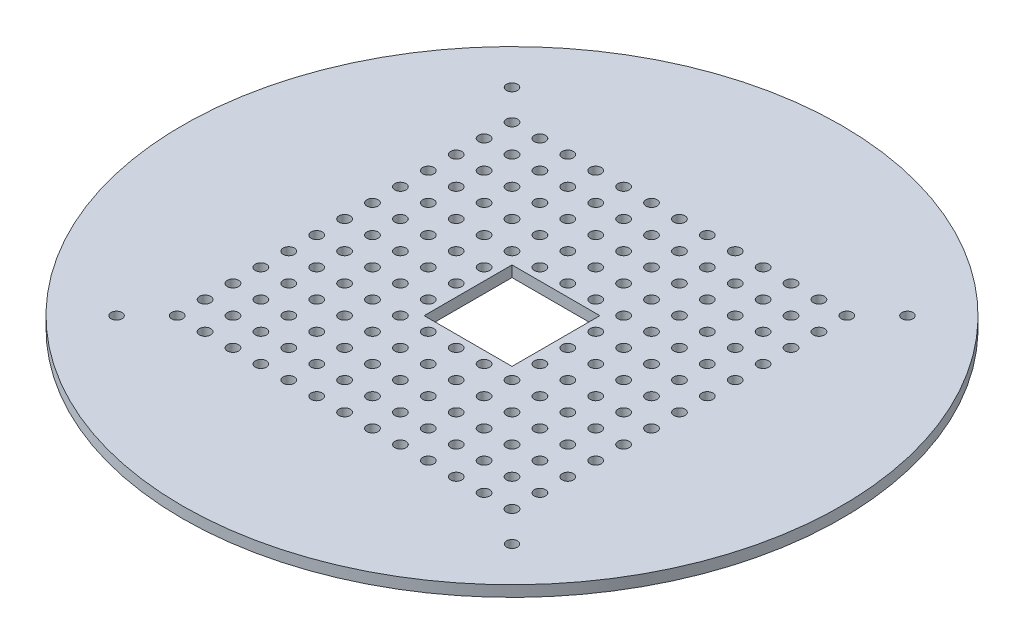
from build123d import *

# Parameters (mm, degrees)
SKETCH_1_R          = 150
SKETCH_1_R_2        = 2.5
SKETCH_1_R_3        = 2.54
EXTRUDE_1_DEPTH     = 5
SKETCH_2_W          = 40
SKETCH_2_H          = 40
CUT_EXTRUDE_1_DEPTH = 213.190951739


with BuildPart() as part:
    # 草图1 → 凸台-拉伸1 (new body)
    with BuildSketch(Plane(origin=(0, 0, 0), x_dir=(1, 0, 0), z_dir=(0, 1, 0))):
        with Locations(Location((0, 0, 0), (0, 0, 270))):
            Circle(SKETCH_1_R)
        with Locations(Location((90, -90, 0), (0, 0, 270))):
            Circle(SKETCH_1_R_2, mode=Mode.SUBTRACT)
        with Locations(Location((90, 90, 0), (0, 0, 270))):
            Circle(SKETCH_1_R_2, mode=Mode.SUBTRACT)
        with Locations(Location((-90, -90, 0), (0, 0, 270))):
            Circle(SKETCH_1_R_2, mode=Mode.SUBTRACT)
        with Locations(Location((-90, 90, 0), (0, 0, 270))):
            Circle(SKETCH_1_R_2, mode=Mode.SUBTRACT)
        with Locations(Location((76.2, 76.2, 0), (0, 0, 270))):
            Circle(SKETCH_1_R_3, mode=Mode.SUBTRACT)
        with Locations(Location((63.5, 76.2, 0), (0, 0, 270))):
            Circle(SKETCH_1_R_3, mode=Mode.SUBTRACT)
        with Locations(Location((50.8, 76.2, 0), (0, 0, 270))):
            Circle(SKETCH_1_R_3, mode=Mode.SUBTRACT)
        with Locations(Location((38.1, 76.2, 0), (0, 0, 270))):
            Circle(SKETCH_1_R_3, mode=Mode.SUBTRACT)
        with Locations(Location((25.4, 76.2, 0), (0, 0, 270))):
            Circle(SKETCH_1_R_3, mode=Mode.SUBTRACT)
        with Locations(Location((12.7, 76.2, 0), (0, 0, 270))):
            Circle(SKETCH_1_R_3, mode=Mode.SUBTRACT)
        with Locations(Location((0, 76.2, 0), (0, 0, 270))):
            Circle(SKETCH_1_R_3, mode=Mode.SUBTRACT)
        with Locations(Location((-12.7, 76.2, 0), (0, 0, 270))):
            Circle(SKETCH_1_R_3, mode=Mode.SUBTRACT)
        with Locations(Location((-25.4, 76.2, 0), (0, 0, 270))):
            Circle(SKETCH_1_R_3, mode=Mode.SUBTRACT)
        with Locations(Location((-38.1, 76.2, 0), (0, 0, 270))):
            Circle(SKETCH_1_R_3, mode=Mode.SUBTRACT)
        with Locations(Location((-50.8, 76.2, 0), (0, 0, 270))):
            Circle(SKETCH_1_R_3, mode=Mode.SUBTRACT)
        with Locations(Location((-63.5, 76.2, 0), (0, 0, 270))):
            Circle(SKETCH_1_R_3, mode=Mode.SUBTRACT)
        with Locations(Location((-76.2, 76.2, 0), (0, 0, 270))):
            Circle(SKETCH_1_R_3, mode=Mode.SUBTRACT)
        with Locations(Location((63.5, 63.5, 0), (0, 0, 270))):
            Circle(SKETCH_1_R_3, mode=Mode.SUBTRACT)
        with Locations(Location((50.8, 63.5, 0), (0, 0, 270))):
            Circle(SKETCH_1_R_3, mode=Mode.SUBTRACT)
        with Locations(Location((38.1, 63.5, 0), (0, 0, 270))):
            Circle(SKETCH_1_R_3, mode=Mode.SUBTRACT)
        with Locations(Location((25.4, 63.5, 0), (0, 0, 270))):
            Circle(SKETCH_1_R_3, mode=Mode.SUBTRACT)
        with Locations(Location((12.7, 63.5, 0), (0, 0, 270))):
            Circle(SKETCH_1_R_3, mode=Mode.SUBTRACT)
        with Locations(Location((0, 63.5, 0), (0, 0, 270))):
            Circle(SKETCH_1_R_3, mode=Mode.SUBTRACT)
        with Locations(Location((-12.7, 63.5, 0), (0, 0, 270))):
            Circle(SKETCH_1_R_3, mode=Mode.SUBTRACT)
        with Locations(Location((-25.4, 63.5, 0), (0, 0, 270))):
            Circle(SKETCH_1_R_3, mode=Mode.SUBTRACT)
        with Locations(Location((-38.1, 63.5, 0), (0, 0, 270))):
            Circle(SKETCH_1_R_3, mode=Mode.SUBTRACT)
        with Locations(Location((-50.8, 63.5, 0), (0, 0, 270))):
            Circle(SKETCH_1_R_3, mode=Mode.SUBTRACT)
        with Locations(Location((-63.5, 63.5, 0), (0, 0, 270))):
            Circle(SKETCH_1_R_3, mode=Mode.SUBTRACT)
        with Locations(Location((-76.2, 63.5, 0), (0, 0, 270))):
            Circle(SKETCH_1_R_3, mode=Mode.SUBTRACT)
        with Locations(Location((63.5, 50.8, 0), (0, 0, 270))):
            Circle(SKETCH_1_R_3, mode=Mode.SUBTRACT)
        with Locations(Location((50.8, 50.8, 0), (0, 0, 270))):
            Circle(SKETCH_1_R_3, mode=Mode.SUBTRACT)
        with Locations(Location((38.1, 50.8, 0), (0, 0, 270))):
            Circle(SKETCH_1_R_3, mode=Mode.SUBTRACT)
        with Locations(Location((25.4, 50.8, 0), (0, 0, 270))):
            Circle(SKETCH_1_R_3, mode=Mode.SUBTRACT)
        with Locations(Location((12.7, 50.8, 0), (0, 0, 270))):
            Circle(SKETCH_1_R_3, mode=Mode.SUBTRACT)
        with Locations(Location((0, 50.8, 0), (0, 0, 270))):
            Circle(SKETCH_1_R_3, mode=Mode.SUBTRACT)
        with Locations(Location((-12.7, 50.8, 0), (0, 0, 270))):
            Circle(SKETCH_1_R_3, mode=Mode.SUBTRACT)
        with Locations(Location((-25.4, 50.8, 0), (0, 0, 270))):
            Circle(SKETCH_1_R_3, mode=Mode.SUBTRACT)
        with Locations(Location((-38.1, 50.8, 0), (0, 0, 270))):
            Circle(SKETCH_1_R_3, mode=Mode.SUBTRACT)
        with Locations(Location((-50.8, 50.8, 0), (0, 0, 270))):
            Circle(SKETCH_1_R_3, mode=Mode.SUBTRACT)
        with Locations(Location((-63.5, 50.8, 0), (0, 0, 270))):
            Circle(SKETCH_1_R_3, mode=Mode.SUBTRACT)
        with Locations(Location((-76.2, 50.8, 0), (0, 0, 270))):
            Circle(SKETCH_1_R_3, mode=Mode.SUBTRACT)
        with Locations(Location((63.5, 38.1, 0), (0, 0, 270))):
            Circle(SKETCH_1_R_3, mode=Mode.SUBTRACT)
        with Locations(Location((50.8, 38.1, 0), (0, 0, 270))):
            Circle(SKETCH_1_R_3, mode=Mode.SUBTRACT)
        with Locations(Location((38.1, 38.1, 0), (0, 0, 270))):
            Circle(SKETCH_1_R_3, mode=Mode.SUBTRACT)
        with Locations(Location((25.4, 38.1, 0), (0, 0, 270))):
            Circle(SKETCH_1_R_3, mode=Mode.SUBTRACT)
        with Locations(Location((12.7, 38.1, 0), (0, 0, 270))):
            Circle(SKETCH_1_R_3, mode=Mode.SUBTRACT)
        with Locations(Location((0, 38.1, 0), (0, 0, 270))):
            Circle(SKETCH_1_R_3, mode=Mode.SUBTRACT)
        with Locations(Location((-12.7, 38.1, 0), (0, 0, 270))):
            Circle(SKETCH_1_R_3, mode=Mode.SUBTRACT)
        with Locations(Location((-25.4, 38.1, 0), (0, 0, 270))):
            Circle(SKETCH_1_R_3, mode=Mode.SUBTRACT)
        with Locations(Location((-38.1, 38.1, 0), (0, 0, 270))):
            Circle(SKETCH_1_R_3, mode=Mode.SUBTRACT)
        with Locations(Location((-50.8, 38.1, 0), (0, 0, 270))):
            Circle(SKETCH_1_R_3, mode=Mode.SUBTRACT)
        with Locations(Location((-63.5, 38.1, 0), (0, 0, 270))):
            Circle(SKETCH_1_R_3, mode=Mode.SUBTRACT)
        with Locations(Location((-76.2, 38.1, 0), (0, 0, 270))):
            Circle(SKETCH_1_R_3, mode=Mode.SUBTRACT)
        with Locations(Location((63.5, 25.4, 0), (0, 0, 270))):
            Circle(SKETCH_1_R_3, mode=Mode.SUBTRACT)
        with Locations(Location((50.8, 25.4, 0), (0, 0, 270))):
            Circle(SKETCH_1_R_3, mode=Mode.SUBTRACT)
        with Locations(Location((38.1, 25.4, 0), (0, 0, 270))):
            Circle(SKETCH_1_R_3, mode=Mode.SUBTRACT)
        with Locations(Location((25.4, 25.4, 0), (0, 0, 270))):
            Circle(SKETCH_1_R_3, mode=Mode.SUBTRACT)
        with Locations(Location((12.7, 25.4, 0), (0, 0, 270))):
            Circle(SKETCH_1_R_3, mode=Mode.SUBTRACT)
        with Locations(Location((0, 25.4, 0), (0, 0, 270))):
            Circle(SKETCH_1_R_3, mode=Mode.SUBTRACT)
        with Locations(Location((-12.7, 25.4, 0), (0, 0, 270))):
            Circle(SKETCH_1_R_3, mode=Mode.SUBTRACT)
        with Locations(Location((-25.4, 25.4, 0), (0, 0, 270))):
            Circle(SKETCH_1_R_3, mode=Mode.SUBTRACT)
        with Locations(Location((-38.1, 25.4, 0), (0, 0, 270))):
            Circle(SKETCH_1_R_3, mode=Mode.SUBTRACT)
        with Locations(Location((-50.8, 25.4, 0), (0, 0, 270))):
            Circle(SKETCH_1_R_3, mode=Mode.SUBTRACT)
        with Locations(Location((-63.5, 25.4, 0), (0, 0, 270))):
            Circle(SKETCH_1_R_3, mode=Mode.SUBTRACT)
        with Locations(Location((-76.2, 25.4, 0), (0, 0, 270))):
            Circle(SKETCH_1_R_3, mode=Mode.SUBTRACT)
        with Locations(Location((63.5, 12.7, 0), (0, 0, 270))):
            Circle(SKETCH_1_R_3, mode=Mode.SUBTRACT)
        with Locations(Location((50.8, 12.7, 0), (0, 0, 270))):
            Circle(SKETCH_1_R_3, mode=Mode.SUBTRACT)
        with Locations(Location((38.1, 12.7, 0), (0, 0, 270))):
            Circle(SKETCH_1_R_3, mode=Mode.SUBTRACT)
        with Locations(Location((25.4, 12.7, 0), (0, 0, 270))):
            Circle(SKETCH_1_R_3, mode=Mode.SUBTRACT)
        with Locations(Location((12.7, 12.7, 0), (0, 0, 270))):
            Circle(SKETCH_1_R_3, mode=Mode.SUBTRACT)
        with Locations(Location((0, 12.7, 0), (0, 0, 270))):
            Circle(SKETCH_1_R_3, mode=Mode.SUBTRACT)
        with Locations(Location((-12.7, 12.7, 0), (0, 0, 270))):
            Circle(SKETCH_1_R_3, mode=Mode.SUBTRACT)
        with Locations(Location((-25.4, 12.7, 0), (0, 0, 270))):
            Circle(SKETCH_1_R_3, mode=Mode.SUBTRACT)
        with Locations(Location((-38.1, 12.7, 0), (0, 0, 270))):
            Circle(SKETCH_1_R_3, mode=Mode.SUBTRACT)
        with Locations(Location((-50.8, 12.7, 0), (0, 0, 270))):
            Circle(SKETCH_1_R_3, mode=Mode.SUBTRACT)
        with Locations(Location((-63.5, 12.7, 0), (0, 0, 270))):
            Circle(SKETCH_1_R_3, mode=Mode.SUBTRACT)
        with Locations(Location((-76.2, 12.7, 0), (0, 0, 270))):
            Circle(SKETCH_1_R_3, mode=Mode.SUBTRACT)
        with Locations(Location((63.5, 0, 0), (0, 0, 270))):
            Circle(SKETCH_1_R_3, mode=Mode.SUBTRACT)
        with Locations(Location((50.8, 0, 0), (0, 0, 270))):
            Circle(SKETCH_1_R_3, mode=Mode.SUBTRACT)
        with Locations(Location((38.1, 0, 0), (0, 0, 270))):
            Circle(SKETCH_1_R_3, mode=Mode.SUBTRACT)
        with Locations(Location((25.4, 0, 0), (0, 0, 270))):
            Circle(SKETCH_1_R_3, mode=Mode.SUBTRACT)
        with Locations(Location((12.7, 0, 0), (0, 0, 270))):
            Circle(SKETCH_1_R_3, mode=Mode.SUBTRACT)
        with Locations(Location((0, 0, 0), (0, 0, 270))):
            Circle(SKETCH_1_R_3, mode=Mode.SUBTRACT)
        with Locations(Location((-12.7, 0, 0), (0, 0, 270))):
            Circle(SKETCH_1_R_3, mode=Mode.SUBTRACT)
        with Locations(Location((-25.4, 0, 0), (0, 0, 270))):
            Circle(SKETCH_1_R_3, mode=Mode.SUBTRACT)
        with Locations(Location((-38.1, 0, 0), (0, 0, 270))):
            Circle(SKETCH_1_R_3, mode=Mode.SUBTRACT)
        with Locations(Location((-50.8, 0, 0), (0, 0, 270))):
            Circle(SKETCH_1_R_3, mode=Mode.SUBTRACT)
        with Locations(Location((-63.5, 0, 0), (0, 0, 270))):
            Circle(SKETCH_1_R_3, mode=Mode.SUBTRACT)
        with Locations(Location((-76.2, 0, 0), (0, 0, 270))):
            Circle(SKETCH_1_R_3, mode=Mode.SUBTRACT)
        with Locations(Location((63.5, -12.7, 0), (0, 0, 270))):
            Circle(SKETCH_1_R_3, mode=Mode.SUBTRACT)
        with Locations(Location((50.8, -12.7, 0), (0, 0, 270))):
            Circle(SKETCH_1_R_3, mode=Mode.SUBTRACT)
        with Locations(Location((38.1, -12.7, 0), (0, 0, 270))):
            Circle(SKETCH_1_R_3, mode=Mode.SUBTRACT)
        with Locations(Location((25.4, -12.7, 0), (0, 0, 270))):
            Circle(SKETCH_1_R_3, mode=Mode.SUBTRACT)
        with Locations(Location((12.7, -12.7, 0), (0, 0, 270))):
            Circle(SKETCH_1_R_3, mode=Mode.SUBTRACT)
        with Locations(Location((0, -12.7, 0), (0, 0, 270))):
            Circle(SKETCH_1_R_3, mode=Mode.SUBTRACT)
        with Locations(Location((-12.7, -12.7, 0), (0, 0, 270))):
            Circle(SKETCH_1_R_3, mode=Mode.SUBTRACT)
        with Locations(Location((-25.4, -12.7, 0), (0, 0, 270))):
            Circle(SKETCH_1_R_3, mode=Mode.SUBTRACT)
        with Locations(Location((-38.1, -12.7, 0), (0, 0, 270))):
            Circle(SKETCH_1_R_3, mode=Mode.SUBTRACT)
        with Locations(Location((-50.8, -12.7, 0), (0, 0, 270))):
            Circle(SKETCH_1_R_3, mode=Mode.SUBTRACT)
        with Locations(Location((-63.5, -12.7, 0), (0, 0, 270))):
            Circle(SKETCH_1_R_3, mode=Mode.SUBTRACT)
        with Locations(Location((-76.2, -12.7, 0), (0, 0, 270))):
            Circle(SKETCH_1_R_3, mode=Mode.SUBTRACT)
        with Locations(Location((63.5, -25.4, 0), (0, 0, 270))):
            Circle(SKETCH_1_R_3, mode=Mode.SUBTRACT)
        with Locations(Location((50.8, -25.4, 0), (0, 0, 270))):
            Circle(SKETCH_1_R_3, mode=Mode.SUBTRACT)
        with Locations(Location((38.1, -25.4, 0), (0, 0, 270))):
            Circle(SKETCH_1_R_3, mode=Mode.SUBTRACT)
        with Locations(Location((25.4, -25.4, 0), (0, 0, 270))):
            Circle(SKETCH_1_R_3, mode=Mode.SUBTRACT)
        with Locations(Location((12.7, -25.4, 0), (0, 0, 270))):
            Circle(SKETCH_1_R_3, mode=Mode.SUBTRACT)
        with Locations(Location((0, -25.4, 0), (0, 0, 270))):
            Circle(SKETCH_1_R_3, mode=Mode.SUBTRACT)
        with Locations(Location((-12.7, -25.4, 0), (0, 0, 270))):
            Circle(SKETCH_1_R_3, mode=Mode.SUBTRACT)
        with Locations(Location((-25.4, -25.4, 0), (0, 0, 270))):
            Circle(SKETCH_1_R_3, mode=Mode.SUBTRACT)
        with Locations(Location((-38.1, -25.4, 0), (0, 0, 270))):
            Circle(SKETCH_1_R_3, mode=Mode.SUBTRACT)
        with Locations(Location((-50.8, -25.4, 0), (0, 0, 270))):
            Circle(SKETCH_1_R_3, mode=Mode.SUBTRACT)
        with Locations(Location((-63.5, -25.4, 0), (0, 0, 270))):
            Circle(SKETCH_1_R_3, mode=Mode.SUBTRACT)
        with Locations(Location((-76.2, -25.4, 0), (0, 0, 270))):
            Circle(SKETCH_1_R_3, mode=Mode.SUBTRACT)
        with Locations(Location((63.5, -38.1, 0), (0, 0, 270))):
            Circle(SKETCH_1_R_3, mode=Mode.SUBTRACT)
        with Locations(Location((50.8, -38.1, 0), (0, 0, 270))):
            Circle(SKETCH_1_R_3, mode=Mode.SUBTRACT)
        with Locations(Location((38.1, -38.1, 0), (0, 0, 270))):
            Circle(SKETCH_1_R_3, mode=Mode.SUBTRACT)
        with Locations(Location((25.4, -38.1, 0), (0, 0, 270))):
            Circle(SKETCH_1_R_3, mode=Mode.SUBTRACT)
        with Locations(Location((12.7, -38.1, 0), (0, 0, 270))):
            Circle(SKETCH_1_R_3, mode=Mode.SUBTRACT)
        with Locations(Location((0, -38.1, 0), (0, 0, 270))):
            Circle(SKETCH_1_R_3, mode=Mode.SUBTRACT)
        with Locations(Location((-12.7, -38.1, 0), (0, 0, 270))):
            Circle(SKETCH_1_R_3, mode=Mode.SUBTRACT)
        with Locations(Location((-25.4, -38.1, 0), (0, 0, 270))):
            Circle(SKETCH_1_R_3, mode=Mode.SUBTRACT)
        with Locations(Location((-38.1, -38.1, 0), (0, 0, 270))):
            Circle(SKETCH_1_R_3, mode=Mode.SUBTRACT)
        with Locations(Location((-50.8, -38.1, 0), (0, 0, 270))):
            Circle(SKETCH_1_R_3, mode=Mode.SUBTRACT)
        with Locations(Location((-63.5, -38.1, 0), (0, 0, 270))):
            Circle(SKETCH_1_R_3, mode=Mode.SUBTRACT)
        with Locations(Location((-76.2, -38.1, 0), (0, 0, 270))):
            Circle(SKETCH_1_R_3, mode=Mode.SUBTRACT)
        with Locations(Location((63.5, -50.8, 0), (0, 0, 270))):
            Circle(SKETCH_1_R_3, mode=Mode.SUBTRACT)
        with Locations(Location((50.8, -50.8, 0), (0, 0, 270))):
            Circle(SKETCH_1_R_3, mode=Mode.SUBTRACT)
        with Locations(Location((38.1, -50.8, 0), (0, 0, 270))):
            Circle(SKETCH_1_R_3, mode=Mode.SUBTRACT)
        with Locations(Location((25.4, -50.8, 0), (0, 0, 270))):
            Circle(SKETCH_1_R_3, mode=Mode.SUBTRACT)
        with Locations(Location((12.7, -50.8, 0), (0, 0, 270))):
            Circle(SKETCH_1_R_3, mode=Mode.SUBTRACT)
        with Locations(Location((0, -50.8, 0), (0, 0, 270))):
            Circle(SKETCH_1_R_3, mode=Mode.SUBTRACT)
        with Locations(Location((-12.7, -50.8, 0), (0, 0, 270))):
            Circle(SKETCH_1_R_3, mode=Mode.SUBTRACT)
        with Locations(Location((-25.4, -50.8, 0), (0, 0, 270))):
            Circle(SKETCH_1_R_3, mode=Mode.SUBTRACT)
        with Locations(Location((-38.1, -50.8, 0), (0, 0, 270))):
            Circle(SKETCH_1_R_3, mode=Mode.SUBTRACT)
        with Locations(Location((-50.8, -50.8, 0), (0, 0, 270))):
            Circle(SKETCH_1_R_3, mode=Mode.SUBTRACT)
        with Locations(Location((-63.5, -50.8, 0), (0, 0, 270))):
            Circle(SKETCH_1_R_3, mode=Mode.SUBTRACT)
        with Locations(Location((-76.2, -50.8, 0), (0, 0, 270))):
            Circle(SKETCH_1_R_3, mode=Mode.SUBTRACT)
        with Locations(Location((63.5, -63.5, 0), (0, 0, 270))):
            Circle(SKETCH_1_R_3, mode=Mode.SUBTRACT)
        with Locations(Location((50.8, -63.5, 0), (0, 0, 270))):
            Circle(SKETCH_1_R_3, mode=Mode.SUBTRACT)
        with Locations(Location((38.1, -63.5, 0), (0, 0, 270))):
            Circle(SKETCH_1_R_3, mode=Mode.SUBTRACT)
        with Locations(Location((25.4, -63.5, 0), (0, 0, 270))):
            Circle(SKETCH_1_R_3, mode=Mode.SUBTRACT)
        with Locations(Location((12.7, -63.5, 0), (0, 0, 270))):
            Circle(SKETCH_1_R_3, mode=Mode.SUBTRACT)
        with Locations(Location((0, -63.5, 0), (0, 0, 270))):
            Circle(SKETCH_1_R_3, mode=Mode.SUBTRACT)
        with Locations(Location((-12.7, -63.5, 0), (0, 0, 270))):
            Circle(SKETCH_1_R_3, mode=Mode.SUBTRACT)
        with Locations(Location((-25.4, -63.5, 0), (0, 0, 270))):
            Circle(SKETCH_1_R_3, mode=Mode.SUBTRACT)
        with Locations(Location((-38.1, -63.5, 0), (0, 0, 270))):
            Circle(SKETCH_1_R_3, mode=Mode.SUBTRACT)
        with Locations(Location((-50.8, -63.5, 0), (0, 0, 270))):
            Circle(SKETCH_1_R_3, mode=Mode.SUBTRACT)
        with Locations(Location((-63.5, -63.5, 0), (0, 0, 270))):
            Circle(SKETCH_1_R_3, mode=Mode.SUBTRACT)
        with Locations(Location((-76.2, -63.5, 0), (0, 0, 270))):
            Circle(SKETCH_1_R_3, mode=Mode.SUBTRACT)
        with Locations(Location((63.5, -76.2, 0), (0, 0, 270))):
            Circle(SKETCH_1_R_3, mode=Mode.SUBTRACT)
        with Locations(Location((50.8, -76.2, 0), (0, 0, 270))):
            Circle(SKETCH_1_R_3, mode=Mode.SUBTRACT)
        with Locations(Location((38.1, -76.2, 0), (0, 0, 270))):
            Circle(SKETCH_1_R_3, mode=Mode.SUBTRACT)
        with Locations(Location((25.4, -76.2, 0), (0, 0, 270))):
            Circle(SKETCH_1_R_3, mode=Mode.SUBTRACT)
        with Locations(Location((12.7, -76.2, 0), (0, 0, 270))):
            Circle(SKETCH_1_R_3, mode=Mode.SUBTRACT)
        with Locations(Location((0, -76.2, 0), (0, 0, 270))):
            Circle(SKETCH_1_R_3, mode=Mode.SUBTRACT)
        with Locations(Location((-12.7, -76.2, 0), (0, 0, 270))):
            Circle(SKETCH_1_R_3, mode=Mode.SUBTRACT)
        with Locations(Location((-25.4, -76.2, 0), (0, 0, 270))):
            Circle(SKETCH_1_R_3, mode=Mode.SUBTRACT)
        with Locations(Location((-38.1, -76.2, 0), (0, 0, 270))):
            Circle(SKETCH_1_R_3, mode=Mode.SUBTRACT)
        with Locations(Location((-50.8, -76.2, 0), (0, 0, 270))):
            Circle(SKETCH_1_R_3, mode=Mode.SUBTRACT)
        with Locations(Location((-63.5, -76.2, 0), (0, 0, 270))):
            Circle(SKETCH_1_R_3, mode=Mode.SUBTRACT)
        with Locations(Location((-76.2, -76.2, 0), (0, 0, 270))):
            Circle(SKETCH_1_R_3, mode=Mode.SUBTRACT)
        with Locations(Location((76.2, 63.5, 0), (0, 0, 270))):
            Circle(SKETCH_1_R_3, mode=Mode.SUBTRACT)
        with Locations(Location((76.2, 50.8, 0), (0, 0, 270))):
            Circle(SKETCH_1_R_3, mode=Mode.SUBTRACT)
        with Locations(Location((76.2, 38.1, 0), (0, 0, 270))):
            Circle(SKETCH_1_R_3, mode=Mode.SUBTRACT)
        with Locations(Location((76.2, 25.4, 0), (0, 0, 270))):
            Circle(SKETCH_1_R_3, mode=Mode.SUBTRACT)
        with Locations(Location((76.2, 12.7, 0), (0, 0, 270))):
            Circle(SKETCH_1_R_3, mode=Mode.SUBTRACT)
        with Locations(Location((76.2, 0, 0), (0, 0, 270))):
            Circle(SKETCH_1_R_3, mode=Mode.SUBTRACT)
        with Locations(Location((76.2, -12.7, 0), (0, 0, 270))):
            Circle(SKETCH_1_R_3, mode=Mode.SUBTRACT)
        with Locations(Location((76.2, -25.4, 0), (0, 0, 270))):
            Circle(SKETCH_1_R_3, mode=Mode.SUBTRACT)
        with Locations(Location((76.2, -38.1, 0), (0, 0, 270))):
            Circle(SKETCH_1_R_3, mode=Mode.SUBTRACT)
        with Locations(Location((76.2, -50.8, 0), (0, 0, 270))):
            Circle(SKETCH_1_R_3, mode=Mode.SUBTRACT)
        with Locations(Location((76.2, -63.5, 0), (0, 0, 270))):
            Circle(SKETCH_1_R_3, mode=Mode.SUBTRACT)
        with Locations(Location((76.2, -76.2, 0), (0, 0, 270))):
            Circle(SKETCH_1_R_3, mode=Mode.SUBTRACT)
    extrude(amount=EXTRUDE_1_DEPTH)

    # 草图2 → 切除-拉伸1 (cut, through all)
    with BuildSketch(Plane(origin=(0, 5, 0), x_dir=(1, 0, 0), z_dir=(0, 1, 0))):
        Rectangle(SKETCH_2_W, SKETCH_2_H)
    extrude(amount=-CUT_EXTRUDE_1_DEPTH, mode=Mode.SUBTRACT)


solid = part.part
